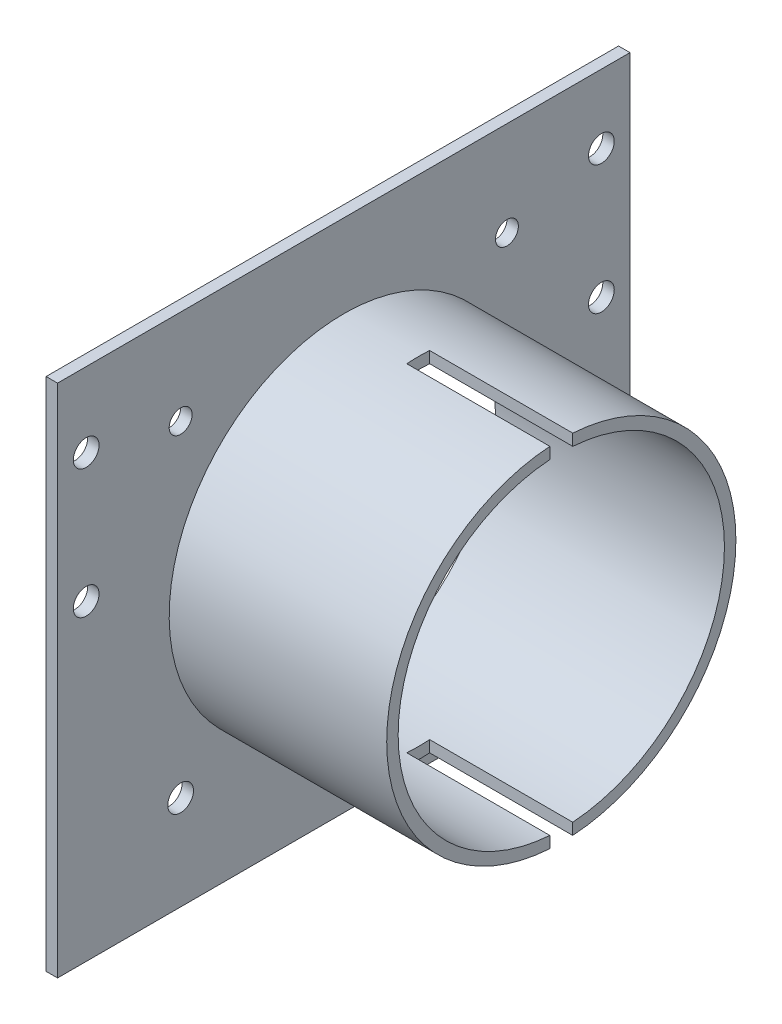
from build123d import *

# Parameters (mm, degrees)
CROQUIS1_W                       = 200
CROQUIS1_H                       = 180
CROQUIS1_R                       = 57
CROQUIS1_R_2                     = 4
SALIENTE_EXTRUIR1_DEPTH          = 4
CROQUIS2_R                       = 61
CROQUIS2_R_2                     = 57
SALIENTE_EXTRUIR2_DEPTH          = 76
CROQUIS3_W                       = 8
CROQUIS3_H                       = 23.163617774
CORTAR_EXTRUIR1_DEPTH            = 50
TALADRO_DE_MARGEN_PARA_M81_D     = 9
TALADRO_DE_MARGEN_PARA_M81_DEPTH = 4.999


with BuildPart() as part:
    # Croquis1 → Saliente-Extruir1 (new body)
    with BuildSketch(Plane(origin=(0, 0, 0), x_dir=(0, 0, -1), z_dir=(1, 0, 0))):
        Rectangle(CROQUIS1_W, CROQUIS1_H)
        Circle(CROQUIS1_R, mode=Mode.SUBTRACT)
        with Locations((-57, 57)):
            Circle(CROQUIS1_R_2, mode=Mode.SUBTRACT)
        with Locations(Location((57, 57, 0), (0, 0, 180))):
            Circle(CROQUIS1_R_2, mode=Mode.SUBTRACT)
        with Locations((57, -57)):
            Circle(CROQUIS1_R_2, mode=Mode.SUBTRACT)
        with Locations(Location((-57, -57, 0), (0, 0, 180))):
            Circle(CROQUIS1_R_2, mode=Mode.SUBTRACT)
    extrude(amount=SALIENTE_EXTRUIR1_DEPTH)

    # Croquis2 → Saliente-Extruir2 (add)
    with BuildSketch(Plane(origin=(4, 0, 0), x_dir=(0, 0, -1), z_dir=(1, 0, 0))):
        Circle(CROQUIS2_R)
        Circle(CROQUIS2_R_2, mode=Mode.SUBTRACT)
    extrude(amount=SALIENTE_EXTRUIR2_DEPTH)

    # Croquis3 → Cortar-Extruir1 (cut)
    with BuildSketch(Plane(origin=(80, 0, 0), x_dir=(0, 0, -1), z_dir=(1, 0, 0))):
        with Locations((0, 57)):
            Rectangle(CROQUIS3_W, CROQUIS3_H)
        with Locations((0, -57)):
            Rectangle(CROQUIS3_W, CROQUIS3_H)
    extrude(amount=-CORTAR_EXTRUIR1_DEPTH, mode=Mode.SUBTRACT)

    # Taladro de margen para M81
    with Locations(Plane(origin=(4, -7.41730184, -252.760845032), x_dir=(0, 0, -1), z_dir=(1, 0, 0))):
        with Locations((-342.760845032, 71.41730184), (-342.760845032, 26.41730184), (-162.760845032, 73.414694032), (-162.760845032, 28.414694032), (-195.760845032, -49.58269816), (-309.760845032, -49.58269816)):
            Hole(TALADRO_DE_MARGEN_PARA_M81_D / 2, depth=TALADRO_DE_MARGEN_PARA_M81_DEPTH)


solid = part.part
